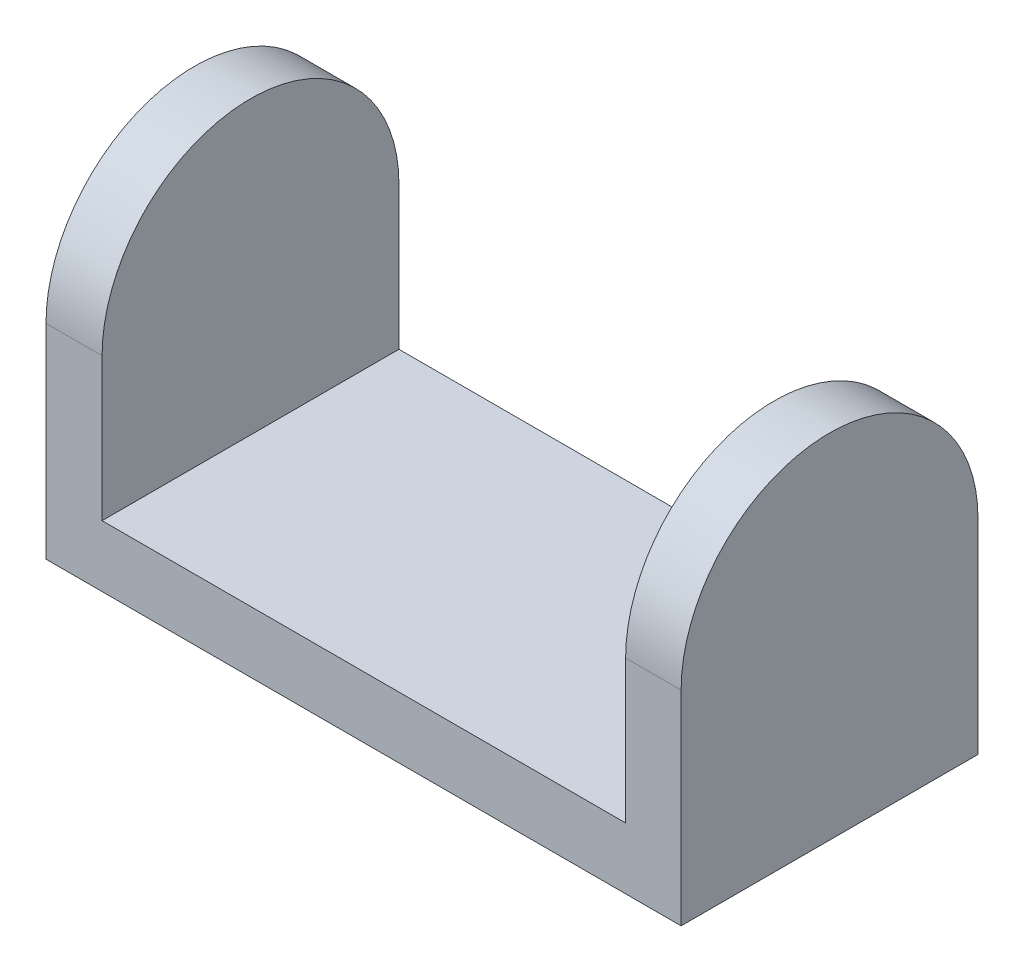
from build123d import *

# Parameters (mm, degrees)
ESQUISSE1_W        = 53.8
ESQUISSE1_H        = 25.15
BOSS_EXTRU_1_DEPTH = 5.2
ESQUISSE2_W        = 4.75
ESQUISSE2_H        = 25.15
BOSS_EXTRU_2_DEPTH = 12.1
BOSS_EXTRU_3_START = -4.75
BOSS_EXTRU_3_DEPTH = 4.75
ESQUISSE4_W        = 4.7
ESQUISSE4_H        = 25.15
BOSS_EXTRU_4_DEPTH = 12.1
BOSS_EXTRU_5_START = -4.7
BOSS_EXTRU_5_DEPTH = 4.7


with BuildPart() as part:
    # Esquisse1 → Boss.-Extru.1 (new body)
    with BuildSketch(Plane(origin=(0, 0, 0), x_dir=(1, 0, 0), z_dir=(0, 1, 0))):
        Rectangle(ESQUISSE1_W, ESQUISSE1_H)
    extrude(amount=BOSS_EXTRU_1_DEPTH)

    # Esquisse2 → Boss.-Extru.2 (add)
    with BuildSketch(Plane(origin=(0, 5.2, 0), x_dir=(1, 0, 0), z_dir=(0, 1, 0))):
        with Locations((-24.525, 0)):
            Rectangle(ESQUISSE2_W, ESQUISSE2_H)
    extrude(amount=BOSS_EXTRU_2_DEPTH)

    # Esquisse3 → Boss.-Extru.3 (add)
    with BuildSketch(Plane.ZY.offset(26.9).offset(BOSS_EXTRU_3_START)):
        with BuildLine():
            Line((12.575, 17.3), (-12.575, 17.3))
            ThreePointArc((-12.575, 17.3), (0, 29.875), (12.575, 17.3))
        make_face()
    extrude(amount=BOSS_EXTRU_3_DEPTH)

    # Esquisse4 → Boss.-Extru.4 (add)
    with BuildSketch(Plane(origin=(0, 5.2, 0), x_dir=(1, 0, 0), z_dir=(0, 1, 0))):
        with Locations((24.55, 0)):
            Rectangle(ESQUISSE4_W, ESQUISSE4_H)
    extrude(amount=BOSS_EXTRU_4_DEPTH)

    # Esquisse5 → Boss.-Extru.5 (add)
    with BuildSketch(Plane(origin=(26.9, 0, 0), x_dir=(0, 0, -1), z_dir=(1, 0, 0)).offset(BOSS_EXTRU_5_START)):
        with BuildLine():
            Line((12.575, 17.3), (-12.575, 17.3))
            ThreePointArc((-12.575, 17.3), (0, 29.875), (12.575, 17.3))
        make_face()
    extrude(amount=BOSS_EXTRU_5_DEPTH)


solid = part.part
